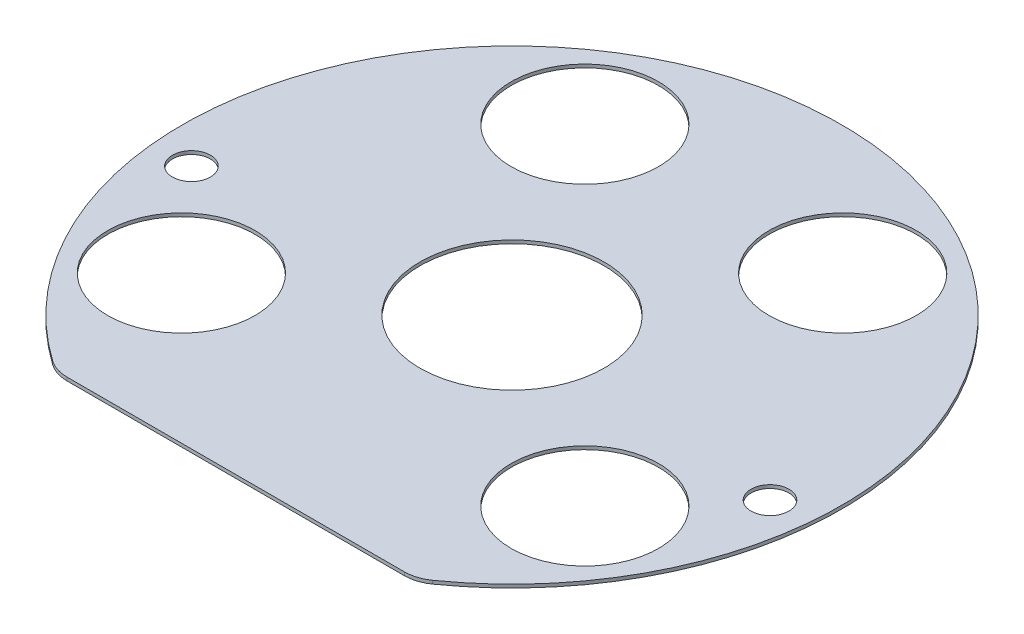
from build123d import *

# Parameters (mm, degrees)
BOSS_EXTRUDE1_DEPTH = 0.91
SKETCH9_R           = 5.15
CUT_EXTRUDE3_DEPTH  = 127.575385048
VISION_PATTERN_R    = 25
VISION_PATTERN_R_2  = 20
CUT_EXTRUDE4_DEPTH  = 127.575385048
FILLET1_R           = 10


with BuildPart() as part:
    # Sketch1 → Boss-Extrude1 (new body)
    with BuildSketch(Plane(origin=(0, 0, 0), x_dir=(1, 0, 0), z_dir=(0, 1, 0))):
        with BuildLine():
            Line((-48.839021284, -75), (48.839021284, -75))
            ThreePointArc((48.839021284, -75), (0, 89.5), (-48.839021284, -75))
        make_face()
    extrude(amount=-BOSS_EXTRUDE1_DEPTH)

    # Sketch9 → Cut-Extrude3 (cut, through all)
    with BuildSketch(Plane(origin=(0, 0, 0), x_dir=(1, 0, 0), z_dir=(0, 1, 0))):
        with Locations(Location((78.541209232, -8.501673503, 0), (0, 0, 270))):
            Circle(SKETCH9_R)
        with Locations(Location((-78.541209232, -8.501673503, 0), (0, 0, 270))):
            Circle(SKETCH9_R)
    extrude(amount=-CUT_EXTRUDE3_DEPTH, mode=Mode.SUBTRACT)

    # Vision Pattern → Cut-Extrude4 (cut, through all)
    with BuildSketch(Plane(origin=(0, 0, 0), x_dir=(1, 0, 0), z_dir=(0, 1, 0))):
        with Locations(Location((0, 0, 0), (0, 0, 270))):
            Circle(VISION_PATTERN_R)
        with Locations(Location((54.772255751, -35, 0), (0, 0, 270))):
            Circle(VISION_PATTERN_R_2)
        with Locations(Location((-54.772255751, -35, 0), (0, 0, 270))):
            Circle(VISION_PATTERN_R_2)
        with Locations(Location((35, 54.772255751, 0), (0, 0, 270))):
            Circle(VISION_PATTERN_R_2)
        with Locations(Location((-35, 54.772255751, 0), (0, 0, 270))):
            Circle(VISION_PATTERN_R_2)
    extrude(amount=-CUT_EXTRUDE4_DEPTH, mode=Mode.SUBTRACT)

    # Fillet1
    fillet1_edges = [part.edges().sort_by_distance(p)[0] for p in [
        (48.839021284, -0.455, 75),
        (-48.839021284, -0.455, 75),
    ]]
    fillet(fillet1_edges, radius=FILLET1_R)


solid = part.part
